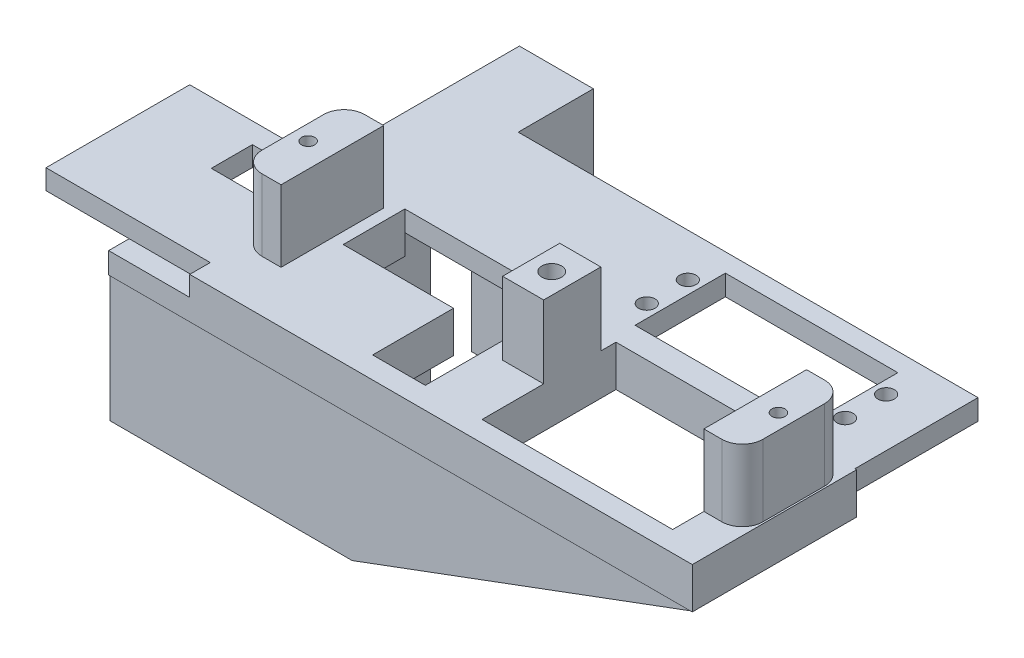
from build123d import *

# Parameters (mm, degrees)
SKETCH1_W            = 120
SKETCH1_H            = 80
BOSS_EXTRUDE1_DEPTH  = 5
SKETCH2_R            = 2.000000001
CUT_EXTRUDE2_DEPTH   = 5
SKETCH3_W            = 90
SKETCH3_H            = 50
CUT_EXTRUDE3_DEPTH   = 5
SKETCH4_W            = 10
SKETCH4_H            = 5
BOSS_EXTRUDE2_DEPTH  = 27.39
SKETCH5_W            = 10
SKETCH5_H            = 5
BOSS_EXTRUDE3_DEPTH  = 20
BOSS_EXTRUDE4_DEPTH  = 17.71
SKETCH7_W            = 10
SKETCH7_H            = 27.39
BOSS_EXTRUDE5_DEPTH  = 17.41
SKETCH8_W            = 10
SKETCH8_H            = 2.39
CUT_EXTRUDE4_DEPTH   = 17.41
SKETCH9_W            = 57.39
SKETCH9_H            = 22.41
CUT_EXTRUDE5_DEPTH   = 0.63
FILLET1_R            = 5
SKETCH10_R           = 1.600000001
CUT_EXTRUDE6_DEPTH   = 94.043840204
SKETCH11_W           = 30
SKETCH11_H           = 5
BOSS_EXTRUDE6_DEPTH  = 2.61
SKETCH12_W           = 9.63
SKETCH12_H           = 5
BOSS_EXTRUDE7_DEPTH  = 27.39
SKETCH13_W           = 9.63
SKETCH13_H           = 25
BOSS_EXTRUDE8_DEPTH  = 17.41
FILLET2_R            = 5
SKETCH14_R           = 1.6
CUT_EXTRUDE7_DEPTH   = 95.747919766
SKETCH15_W           = 122.4
SKETCH15_H           = 10
BOSS_EXTRUDE9_DEPTH  = 40
SKETCH16_W           = 30
SKETCH16_H           = 50
CUT_EXTRUDE8_DEPTH   = 104.119620829
SKETCH17_W           = 35.000212548
SKETCH17_H           = 4.85
BOSS_EXTRUDE10_DEPTH = 40
SKETCH18_W           = 20
SKETCH18_H           = 4.85
BOSS_EXTRUDE11_DEPTH = 60
SKETCH19_W           = 10
SKETCH19_H           = 4.85
BOSS_EXTRUDE12_DEPTH = 30
SKETCH20_W           = 18.02
SKETCH20_H           = 65
BOSS_EXTRUDE13_DEPTH = 53.74
SKETCH21_R           = 2.4
CUT_EXTRUDE9_DEPTH   = 25
BOSS_EXTRUDE14_DEPTH = 30.87
SKETCH28_W           = 42.63693761
SKETCH28_H           = 22.549263077
CUT_EXTRUDE11_DEPTH  = 32
SKETCH29_W           = 11.98
SKETCH29_H           = 4.85
CUT_EXTRUDE12_DEPTH  = 60
BOSS_EXTRUDE15_DEPTH = 19.742742811
BOSS_EXTRUDE16_DEPTH = 5
SKETCH32_W           = 42
SKETCH32_H           = 22
CUT_EXTRUDE13_DEPTH  = 25
SKETCH33_W           = 18.02
SKETCH33_H           = 28
CUT_EXTRUDE14_DEPTH  = 50
SKETCH34_W           = 18.02
SKETCH34_H           = 11.692668542
CUT_EXTRUDE15_DEPTH  = 60
SKETCH35_W           = 19.707106781
SKETCH35_H           = 20
CUT_EXTRUDE16_DEPTH  = 60
SKETCH36_W           = 46.41
SKETCH36_H           = 32.61
CUT_EXTRUDE18_DEPTH  = 60
SKETCH38_W           = 17.837944425
SKETCH38_H           = 10.006474067
CUT_EXTRUDE20_DEPTH  = 49
CUT_EXTRUDE21_START  = -49
SKETCH39_R           = 1.6
SKETCH39_R_2         = 1.600000001
CUT_EXTRUDE21_DEPTH  = 49


with BuildPart() as part:
    # Sketch1 → Boss-Extrude1 (new body)
    with BuildSketch(Plane(origin=(0, 0, 0), x_dir=(1, 0, 0), z_dir=(0, 1, 0))):
        Rectangle(SKETCH1_W, SKETCH1_H)
    extrude(amount=BOSS_EXTRUDE1_DEPTH)

    # Sketch2 → Cut-Extrude2 (cut)
    with BuildSketch(Plane(origin=(0, 5, 0), x_dir=(1, 0, 0), z_dir=(0, 1, 0))):
        with Locations(Location((47.5, -20.500000004, 0), (0, 0, 270))):
            Circle(SKETCH2_R)
        with Locations(Location((47.5, -30.500000004, 0), (0, 0, 270))):
            Circle(SKETCH2_R)
        with Locations(Location((-0.8, -30.500000004, 0), (0, 0, 270))):
            Circle(SKETCH2_R)
        with Locations(Location((-0.8, -20.500000004, 0), (0, 0, 270))):
            Circle(SKETCH2_R)
    extrude(amount=-CUT_EXTRUDE2_DEPTH, mode=Mode.SUBTRACT)

    # Sketch3 → Cut-Extrude3 (cut)
    with BuildSketch(Plane(origin=(0, 5, 0), x_dir=(1, 0, 0), z_dir=(0, 1, 0))):
        with Locations((15, 15)):
            Rectangle(SKETCH3_W, SKETCH3_H)
    extrude(amount=-CUT_EXTRUDE3_DEPTH, mode=Mode.SUBTRACT)

    # Sketch4 → Boss-Extrude2 (add)
    with BuildSketch(Plane.XY.offset(40)):
        with Locations((55, 2.5)):
            Rectangle(SKETCH4_W, SKETCH4_H)
    extrude(amount=BOSS_EXTRUDE2_DEPTH)

    # Sketch5 → Boss-Extrude3 (add)
    with BuildSketch(Plane.XY.offset(40)):
        with Locations((-1.41, 2.5)):
            Rectangle(SKETCH5_W, SKETCH5_H)
    extrude(amount=BOSS_EXTRUDE3_DEPTH)

    # Sketch6 → Boss-Extrude4 (add)
    with BuildSketch(Plane(origin=(0, 5, 0), x_dir=(1, 0, 0), z_dir=(0, 1, 0))):
        with BuildLine():
            ThreePointArc((-3.81, -53.04), (-1.41, -50.64), (0.99, -53.04))
            Line((0.99, -53.04), (3.59, -53.04))
            Line((3.59, -53.04), (3.59, -46.08))
            Line((3.59, -46.08), (-6.41, -46.08))
            Line((-6.41, -46.08), (-6.41, -53.04))
            Line((-6.41, -53.04), (-3.81, -53.04))
        make_face()
        with BuildLine():
            Line((3.59, -53.04), (0.99, -53.04))
            ThreePointArc((0.99, -53.04), (-1.41, -55.44), (-3.81, -53.04))
            Line((-3.81, -53.04), (-6.41, -53.04))
            Line((-6.41, -53.04), (-6.41, -60))
            Line((-6.41, -60), (3.59, -60))
            Line((3.59, -60), (3.59, -53.04))
        make_face()
    extrude(amount=BOSS_EXTRUDE4_DEPTH)

    # Sketch7 → Boss-Extrude5 (add)
    with BuildSketch(Plane(origin=(0, 5, 0), x_dir=(1, 0, 0), z_dir=(0, 1, 0))):
        with Locations((55, -53.695)):
            Rectangle(SKETCH7_W, SKETCH7_H)
    extrude(amount=BOSS_EXTRUDE5_DEPTH)

    # Sketch8 → Cut-Extrude4 (cut)
    with BuildSketch(Plane(origin=(0, 22.41, 0), x_dir=(1, 0, 0), z_dir=(0, 1, 0))):
        with Locations((55, -41.195)):
            Rectangle(SKETCH8_W, SKETCH8_H)
    extrude(amount=-CUT_EXTRUDE4_DEPTH, mode=Mode.SUBTRACT)

    # Sketch9 → Cut-Extrude5 (cut)
    with BuildSketch(Plane(origin=(60, 0, 0), x_dir=(0, 0, -1), z_dir=(1, 0, 0))):
        with Locations((-38.695, 11.205)):
            Rectangle(SKETCH9_W, SKETCH9_H)
    extrude(amount=-CUT_EXTRUDE5_DEPTH, mode=Mode.SUBTRACT)

    # Fillet1
    fillet1_edges = [part.edges().sort_by_distance(p)[0] for p in [
        (59.37, 13.705, 42.39),
        (59.37, 11.205, 67.39),
    ]]
    fillet(fillet1_edges, radius=FILLET1_R)

    # Sketch10 → Cut-Extrude6 (cut, through all)
    with BuildSketch(Plane.XZ):
        with Locations(Location((55.658310639, 54.885337085, 0), (0, 0, 270))):
            Circle(SKETCH10_R)
    extrude(amount=-CUT_EXTRUDE6_DEPTH, mode=Mode.SUBTRACT)

    # Sketch11 → Boss-Extrude6 (add)
    with BuildSketch(Plane.ZY.offset(60)):
        with Locations((25, 2.5)):
            Rectangle(SKETCH11_W, SKETCH11_H)
    extrude(amount=BOSS_EXTRUDE6_DEPTH)

    # Sketch12 → Boss-Extrude7 (add)
    with BuildSketch(Plane.XY.offset(40)):
        with Locations((-57.795, 2.5)):
            Rectangle(SKETCH12_W, SKETCH12_H)
    extrude(amount=BOSS_EXTRUDE7_DEPTH)

    # Sketch13 → Boss-Extrude8 (add)
    with BuildSketch(Plane(origin=(0, 5, 0), x_dir=(1, 0, 0), z_dir=(0, 1, 0))):
        with Locations((-57.795, -54.89)):
            Rectangle(SKETCH13_W, SKETCH13_H)
    extrude(amount=BOSS_EXTRUDE8_DEPTH)

    # Fillet2
    fillet2_edges = [part.edges().sort_by_distance(p)[0] for p in [
        (-62.61, 11.205, 67.39),
        (-62.61, 13.705, 42.39),
    ]]
    fillet(fillet2_edges, radius=FILLET2_R)

    # Sketch14 → Cut-Extrude7 (cut, through all)
    with BuildSketch(Plane(origin=(0, 0, 0), x_dir=(-1, 0, 0), z_dir=(0, -1, 0))):
        with Locations(Location((58.892597711, -54.885337085, 0), (0, 0, 90))):
            Circle(SKETCH14_R)
    extrude(amount=-CUT_EXTRUDE7_DEPTH, mode=Mode.SUBTRACT)

    # Sketch15 → Boss-Extrude9 (add)
    with BuildSketch(Plane.XY.offset(40)):
        with Locations((-1.41, 0)):
            Rectangle(SKETCH15_W, SKETCH15_H)
    extrude(amount=BOSS_EXTRUDE9_DEPTH)

    # Sketch16 → Cut-Extrude8 (cut, through all)
    with BuildSketch(Plane(origin=(0, 5, 0), x_dir=(1, 0, 0), z_dir=(0, 1, 0))):
        with Locations((-45, 15)):
            Rectangle(SKETCH16_W, SKETCH16_H)
    extrude(amount=-CUT_EXTRUDE8_DEPTH, mode=Mode.SUBTRACT)

    # Sketch17 → Boss-Extrude10 (add)
    with BuildSketch(Plane.ZY.offset(62.61)):
        with Locations((57.500106274, 2.575)):
            Rectangle(SKETCH17_W, SKETCH17_H)
    extrude(amount=BOSS_EXTRUDE10_DEPTH)

    # Sketch18 → Boss-Extrude11 (add)
    with BuildSketch(Plane(origin=(0, 0, 40), x_dir=(-1, 0, 0), z_dir=(0, 0, -1))):
        with Locations((72.61, 2.575)):
            Rectangle(SKETCH18_W, SKETCH18_H)
    extrude(amount=BOSS_EXTRUDE11_DEPTH)

    # Sketch19 → Boss-Extrude12 (add)
    with BuildSketch(Plane(origin=(0, 0, 10), x_dir=(-1, 0, 0), z_dir=(0, 0, -1))):
        with Locations((57.61, 2.575)):
            Rectangle(SKETCH19_W, SKETCH19_H)
    extrude(amount=BOSS_EXTRUDE12_DEPTH)

    # Sketch20 → Boss-Extrude13 (add)
    with BuildSketch(Plane.XZ.offset(-0.15)):
        with Locations((-61.62, 12.5)):
            Rectangle(SKETCH20_W, SKETCH20_H)
    extrude(amount=BOSS_EXTRUDE13_DEPTH)

    # Sketch21 → Cut-Extrude9 (cut)
    with BuildSketch(Plane.XZ.offset(53.59)):
        with Locations(Location((-61.617143537, 37.385337084, 0), (0, 0, 270))):
            Circle(SKETCH21_R)
        with Locations(Location((-61.617143537, -2.614662916, 0), (0, 0, 270))):
            Circle(SKETCH21_R)
    extrude(amount=-CUT_EXTRUDE9_DEPTH, mode=Mode.SUBTRACT)

    # Sketch25 → Boss-Extrude14 (add)
    with BuildSketch(Plane.XZ.offset(5)):
        with BuildLine():
            Line((-62.61, 76.713580848), (-62.61, 79.713580848))
            Line((-62.61, 79.713580848), (-82.352742811, 79.713580848))
            Line((-82.352742811, 79.713580848), (-82.352742811, 55.006474067))
            Line((-82.352742811, 55.006474067), (-62.61, 55.006474067))
            Line((-62.61, 55.006474067), (-62.61, 58.006474067))
            Line((-62.61, 58.006474067), (-79.352742811, 58.006474067))
            Line((-79.352742811, 58.006474067), (-79.352742811, 61.890148284))
            ThreePointArc((-79.352742811, 61.890148284), (-79.39918942, 62.360027458), (-79.352742811, 62.829906631))
            Line((-79.352742811, 62.829906631), (-79.352742811, 71.890148284))
            ThreePointArc((-79.352742811, 71.890148284), (-79.39918942, 72.360027458), (-79.352742811, 72.829906631))
            Line((-79.352742811, 72.829906631), (-79.352742811, 76.713580848))
            Line((-79.352742811, 76.713580848), (-62.61, 76.713580848))
        make_face()
        with BuildLine():
            Line((-23.34563603, 55.006474067), (-23.34563603, 79.713580848))
            Line((-23.34563603, 79.713580848), (-62.61, 79.713580848))
            Line((-62.61, 79.713580848), (-62.61, 76.713580848))
            Line((-62.61, 76.713580848), (-26.34563603, 76.713580848))
            Line((-26.34563603, 76.713580848), (-26.34563603, 72.829906631))
            ThreePointArc((-26.34563603, 72.829906631), (-26.310829299, 72.596112043), (-26.29918942, 72.360027458))
            ThreePointArc((-26.29918942, 72.360027458), (-26.310829299, 72.123942872), (-26.34563603, 71.890148284))
            Line((-26.34563603, 71.890148284), (-26.34563603, 62.829906631))
            ThreePointArc((-26.34563603, 62.829906631), (-26.310829299, 62.596112043), (-26.29918942, 62.360027458))
            ThreePointArc((-26.29918942, 62.360027458), (-26.310829299, 62.123942872), (-26.34563603, 61.890148284))
            Line((-26.34563603, 61.890148284), (-26.34563603, 58.006474067))
            Line((-26.34563603, 58.006474067), (-62.61, 58.006474067))
            Line((-62.61, 58.006474067), (-62.61, 55.006474067))
            Line((-62.61, 55.006474067), (-23.34563603, 55.006474067))
        make_face()
        with BuildLine():
            Line((-26.34563603, 76.713580848), (-62.61, 76.713580848))
            Line((-62.61, 76.713580848), (-62.61, 58.006474067))
            Line((-62.61, 58.006474067), (-26.34563603, 58.006474067))
            Line((-26.34563603, 58.006474067), (-26.34563603, 61.890148284))
            ThreePointArc((-26.34563603, 61.890148284), (-31.09918942, 62.360027458), (-26.34563603, 62.829906631))
            Line((-26.34563603, 62.829906631), (-26.34563603, 71.890148284))
            ThreePointArc((-26.34563603, 71.890148284), (-31.09918942, 72.360027458), (-26.34563603, 72.829906631))
            Line((-26.34563603, 72.829906631), (-26.34563603, 76.713580848))
        make_face()
        with BuildLine():
            Line((-62.61, 58.006474067), (-62.61, 76.713580848))
            Line((-62.61, 76.713580848), (-79.352742811, 76.713580848))
            Line((-79.352742811, 76.713580848), (-79.352742811, 72.829906631))
            ThreePointArc((-79.352742811, 72.829906631), (-76.763104835, 74.748387579), (-74.59918942, 72.360027458))
            ThreePointArc((-74.59918942, 72.360027458), (-76.763104835, 69.971667336), (-79.352742811, 71.890148284))
            Line((-79.352742811, 71.890148284), (-79.352742811, 62.829906631))
            ThreePointArc((-79.352742811, 62.829906631), (-76.763104835, 64.748387579), (-74.59918942, 62.360027458))
            ThreePointArc((-74.59918942, 62.360027458), (-76.763104835, 59.971667336), (-79.352742811, 61.890148284))
            Line((-79.352742811, 61.890148284), (-79.352742811, 58.006474067))
            Line((-79.352742811, 58.006474067), (-62.61, 58.006474067))
        make_face()
    extrude(amount=BOSS_EXTRUDE14_DEPTH)

    # Sketch28 → Cut-Extrude11 (cut)
    with BuildSketch(Plane.XZ.offset(35.87)):
        with Locations((-52.879821914, 67.447674241)):
            Rectangle(SKETCH28_W, SKETCH28_H)
    extrude(amount=-CUT_EXTRUDE11_DEPTH, mode=Mode.SUBTRACT)

    # Sketch29 → Cut-Extrude12 (cut)
    with BuildSketch(Plane(origin=(0, 0, -20), x_dir=(-1, 0, 0), z_dir=(0, 0, -1))):
        with Locations((76.62, 2.575)):
            Rectangle(SKETCH29_W, SKETCH29_H)
    extrude(amount=-CUT_EXTRUDE12_DEPTH, mode=Mode.SUBTRACT)

    # Sketch30 → Boss-Extrude15 (add)
    with BuildSketch(Plane.ZY.offset(62.61)):
        Polygon((56.173042703, -5), (45, -5), (45, 0.15), (80, 0.15), (80, -5), (78.72230578, -5), align=None)
    extrude(amount=BOSS_EXTRUDE15_DEPTH)

    # Sketch31 → Boss-Extrude16 (add)
    with BuildSketch(Plane.XY.offset(79.713580848)):
        Polygon((-23.34563603, -35.87), (59.79, -5), (-23.34563603, -5), align=None)
    extrude(amount=-BOSS_EXTRUDE16_DEPTH)

    # Sketch32 → Cut-Extrude13 (cut)
    with BuildSketch(Plane(origin=(0, 5, 0), x_dir=(1, 0, 0), z_dir=(0, 1, 0))):
        with Locations((23.35, -25.500000004)):
            Rectangle(SKETCH32_W, SKETCH32_H)
    extrude(amount=-CUT_EXTRUDE13_DEPTH, mode=Mode.SUBTRACT)

    # Sketch33 → Cut-Extrude14 (cut)
    with BuildSketch(Plane.XZ.offset(53.59)):
        with Locations((-61.62, 17.385337084)):
            Rectangle(SKETCH33_W, SKETCH33_H)
    extrude(amount=-CUT_EXTRUDE14_DEPTH, mode=Mode.SUBTRACT)

    # Sketch34 → Cut-Extrude15 (cut)
    with BuildSketch(Plane.XZ.offset(53.59)):
        with Locations((-61.62, -14.153665729)):
            Rectangle(SKETCH34_W, SKETCH34_H)
    extrude(amount=-CUT_EXTRUDE15_DEPTH, mode=Mode.SUBTRACT)

    # Sketch35 → Cut-Extrude16 (cut)
    with BuildSketch(Plane(origin=(-23.34563603, 0, 0), x_dir=(0, 0, -1), z_dir=(1, 0, 0))):
        with Locations((-64.860027458, -15)):
            Rectangle(SKETCH35_W, SKETCH35_H)
    extrude(amount=-CUT_EXTRUDE16_DEPTH, mode=Mode.SUBTRACT)

    # Sketch36 → Cut-Extrude18 (cut)
    with BuildSketch(Plane(origin=(0, 5, 0), x_dir=(1, 0, 0), z_dir=(0, 1, 0))):
        with Locations((26.795, -58.695)):
            Rectangle(SKETCH36_W, SKETCH36_H)
    extrude(amount=-CUT_EXTRUDE18_DEPTH, mode=Mode.SUBTRACT)

    # Sketch38 → Cut-Extrude20 (cut)
    with BuildSketch(Plane(origin=(0, 5, 0), x_dir=(1, 0, 0), z_dir=(0, 1, 0))):
        with Locations((-73.433770599, -50.003237033)):
            Rectangle(SKETCH38_W, SKETCH38_H)
        Polygon((-50.215916204, -40), (-50.215916204, -55.006474067), (-23.34563603, -55.006474067), (-23.34563603, -74.713580848), (-10.521709133, -74.713580848), (-10.521709133, -40), align=None)
    extrude(amount=-CUT_EXTRUDE20_DEPTH, mode=Mode.SUBTRACT)

    # Sketch39 → Cut-Extrude21 (cut)
    with BuildSketch(Plane(origin=(0, 22.41, 0), x_dir=(1, 0, 0), z_dir=(0, 1, 0)).offset(CUT_EXTRUDE21_START)):
        with Locations(Location((-58.892597711, -54.885337085, 0), (0, 0, 90))):
            Circle(SKETCH39_R)
        with Locations(Location((55.658310639, -54.885337085, 0), (0, 0, 90))):
            Circle(SKETCH39_R_2)
    extrude(amount=CUT_EXTRUDE21_DEPTH, mode=Mode.SUBTRACT)


solid = part.part
